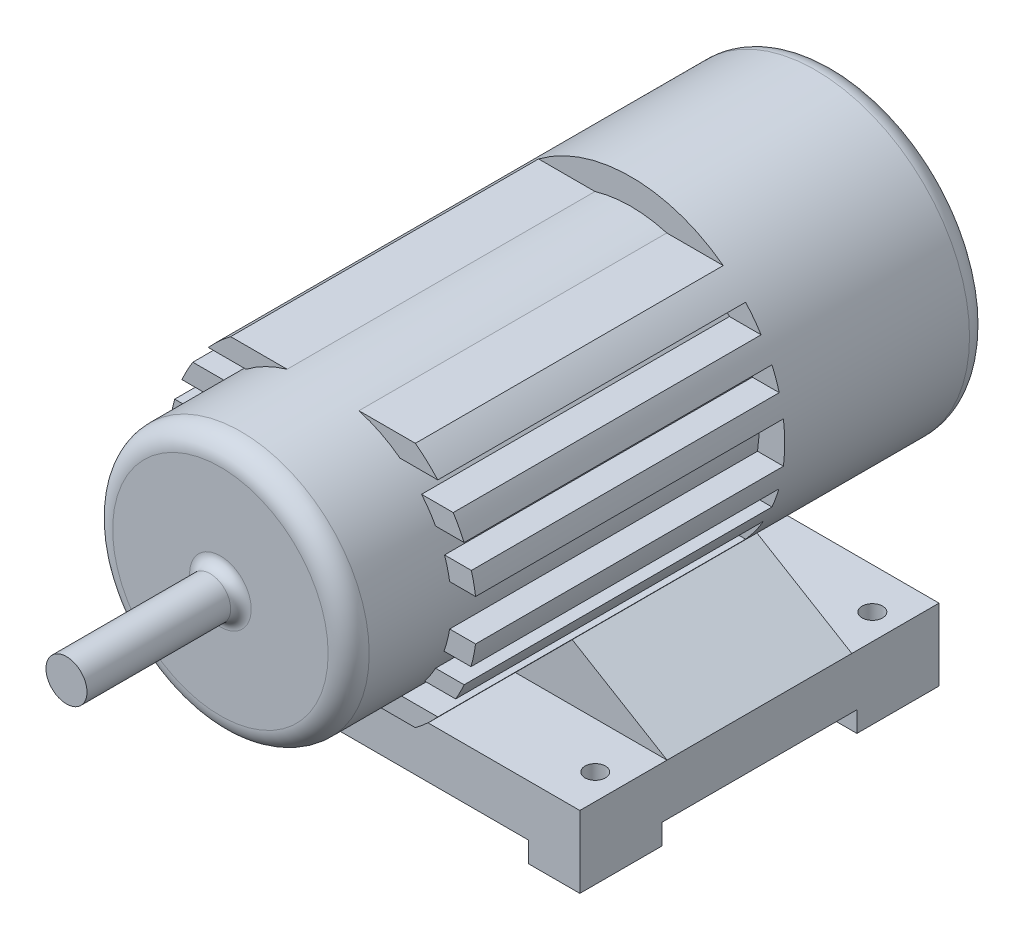
from build123d import *
from build123d.topology import SkipClean

# Parameters (mm, degrees)
SKETCH1_R            = 150
BOSS_EXTRUDE1_DEPTH  = 200
BOSS_EXTRUDE11_DEPTH = 300
BOSS_EXTRUDE14_START = -300
SKETCH12_R           = 125
BOSS_EXTRUDE14_DEPTH = 400
SKETCH13_W           = 400
SKETCH13_H           = 350
SKETCH13_R           = 10
BOSS_EXTRUDE15_DEPTH = 50
SKETCH13_3_W         = 50
SKETCH13_3_H         = 80
SKETCH13_3_R         = 10
BOSS_EXTRUDE16_DEPTH = 20
BOSS_EXTRUDE17_DEPTH = 90
SKETCH16_R           = 20
BOSS_EXTRUDE18_DEPTH = 150
FILLET2_R            = 10
FILLET3_R            = 20


with BuildPart() as part:
    # Sketch1 → Boss-Extrude1 (new body)
    with BuildSketch(Plane.XY):
        Circle(SKETCH1_R)
    extrude(amount=BOSS_EXTRUDE1_DEPTH)

    # Sketch7 → Boss-Extrude11 (add)
    with SkipClean():  # the faces are left unmerged after this step: merging them gives an invalid solid
        with BuildSketch(Plane.XY.offset(200)):
            with BuildLine():
                Line((-90, 120), (90, 120))
                ThreePointArc((90, 120), (101.396020382, 110.538893837), (111.803398875, 100))
                Line((111.803398875, 100), (-111.803398875, 100))
                ThreePointArc((-111.803398875, 100), (-101.396020382, 110.538893837), (-90, 120))
            make_face()
            with BuildLine():
                Line((-126.885775404, 80), (126.885775404, 80))
                ThreePointArc((126.885775404, 80), (132.559251115, 70.200035213), (137.477270849, 60))
                Line((137.477270849, 60), (-137.477270849, 60))
                ThreePointArc((-137.477270849, 60), (-132.559251115, 70.200035213), (-126.885775404, 80))
            make_face()
            with BuildLine():
                Line((144.16342013, -41.435592144), (-144.16342013, -41.435592144))
                ThreePointArc((-144.16342013, -41.435592144), (-146.803816882, -30.799989431), (-148.660687473, -20))
                Line((-148.660687473, -20), (148.660687473, -20))
                ThreePointArc((148.660687473, -20), (146.803816882, -30.799989431), (144.16342013, -41.435592144))
            make_face()
            with BuildLine():
                Line((111.803398875, -100), (-111.803398875, -100))
                ThreePointArc((-111.803398875, -100), (-101.396020382, -110.538893837), (-90, -120))
                Line((-90, -120), (90, -120))
                ThreePointArc((90, -120), (101.396020382, -110.538893837), (111.803398875, -100))
            make_face()
            with BuildLine():
                Line((144.568322948, 40), (-144.568322948, 40))
                ThreePointArc((-144.568322948, 40), (-146.955139883, 30.069700063), (-148.660687473, 20))
                Line((-148.660687473, 20), (148.660687473, 20))
                ThreePointArc((148.660687473, 20), (146.955139883, 30.069700063), (144.568322948, 40))
            make_face()
            with BuildLine():
                Line((137.477270849, -60), (-137.477270849, -60))
                ThreePointArc((-137.477270849, -60), (-133.599215205, -68.20007109), (-129.232599216, -76.150740639))
                Line((-129.232599216, -76.150740639), (129.232599216, -76.150740639))
                ThreePointArc((129.232599216, -76.150740639), (133.599215205, -68.20007109), (137.477270849, -60))
            make_face()
        extrude(amount=BOSS_EXTRUDE11_DEPTH)



with BuildPart() as body_2:
    # Sketch12 → Boss-Extrude14 (new body)
    with BuildSketch(Plane.XY.offset(500).offset(BOSS_EXTRUDE14_START)):
        Circle(SKETCH12_R)
    extrude(amount=BOSS_EXTRUDE14_DEPTH)


with BuildPart() as body_3:
    # Sketch13 → Boss-Extrude15 (new body)
    with BuildSketch(Plane(origin=(0, -210, 0), x_dir=(-1, 0, 0), z_dir=(0, -1, 0))):
        with Locations((0, -274.735715433)):
            Rectangle(SKETCH13_W, SKETCH13_H)
        with Locations(Location((-175, -139.735715433, 0), (0, 0, 180))):
            Circle(SKETCH13_R, mode=Mode.SUBTRACT)
        with Locations(Location((175, -139.735715433, 0), (0, 0, 180))):
            Circle(SKETCH13_R, mode=Mode.SUBTRACT)
        with Locations(Location((175, -409.735715433, 0), (0, 0, 180))):
            Circle(SKETCH13_R, mode=Mode.SUBTRACT)
        with Locations(Location((-175, -409.735715433, 0), (0, 0, 180))):
            Circle(SKETCH13_R, mode=Mode.SUBTRACT)
    extrude(amount=-BOSS_EXTRUDE15_DEPTH)

    # Sketch13<3> → Boss-Extrude16 (add)
    # profile 1 of 4: a face of its own
    with BuildSketch(Plane(origin=(0, -210, 0), x_dir=(-1, 0, 0), z_dir=(0, -1, 0))):
        with Locations((-175, -409.735715433)):
            Rectangle(SKETCH13_3_W, SKETCH13_3_H)
        with Locations(Location((-175, -409.735715433, 0), (0, 0, 180))):
            Circle(SKETCH13_3_R, mode=Mode.SUBTRACT)
    # profile 2 of 4: a face of its own
    with BuildSketch(Plane(origin=(0, -210, 0), x_dir=(-1, 0, 0), z_dir=(0, -1, 0))):
        with Locations((-175, -139.735715433)):
            Rectangle(SKETCH13_3_W, SKETCH13_3_H)
        with Locations(Location((-175, -139.735715433, 0), (0, 0, 180))):
            Circle(SKETCH13_3_R, mode=Mode.SUBTRACT)
    # profile 3 of 4: a face of its own
    with BuildSketch(Plane(origin=(0, -210, 0), x_dir=(-1, 0, 0), z_dir=(0, -1, 0))):
        with Locations((175, -409.735715433)):
            Rectangle(SKETCH13_3_W, SKETCH13_3_H)
        with Locations(Location((175, -409.735715433, 0), (0, 0, 180))):
            Circle(SKETCH13_3_R, mode=Mode.SUBTRACT)
    # profile 4 of 4: a face of its own
    with BuildSketch(Plane(origin=(0, -210, 0), x_dir=(-1, 0, 0), z_dir=(0, -1, 0))):
        with Locations((175, -139.735715433)):
            Rectangle(SKETCH13_3_W, SKETCH13_3_H)
        with Locations(Location((175, -139.735715433, 0), (0, 0, 180))):
            Circle(SKETCH13_3_R, mode=Mode.SUBTRACT)
    extrude(amount=BOSS_EXTRUDE16_DEPTH)


with BuildPart() as part_1:
    with SkipClean():  # the faces are left unmerged after this step: merging them gives an invalid solid
        add(part.part)

        add(body_2.part)  # Boss-Extrude17 merges body 2

        add(body_3.part)  # Boss-Extrude17 merges body 3
        # Sketch14 → Boss-Extrude17 (add, symmetric)
        with BuildSketch(Plane.XY.offset(274.735715433)):
            Polygon((-200, -160), (200, -160), (100, -100), (-100, -100), align=None)
        extrude(amount=BOSS_EXTRUDE17_DEPTH, both=True)

    # Sketch16 → Boss-Extrude18 (add)
    with BuildSketch(Plane.XY.offset(600)):
        Circle(SKETCH16_R)
    extrude(amount=BOSS_EXTRUDE18_DEPTH)

    # Fillet2
    fillet2_edges = [part_1.edges().sort_by_distance(p)[0] for p in [
        (-20, 0, 600),
    ]]
    fillet(fillet2_edges, radius=FILLET2_R)

    # Fillet3
    fillet3_edges = [part_1.edges().sort_by_distance(p)[0] for p in [
        (-125, 0, 600),
        (-150, 0, 0),
    ]]
    fillet(fillet3_edges, radius=FILLET3_R)


solid = part_1.part
